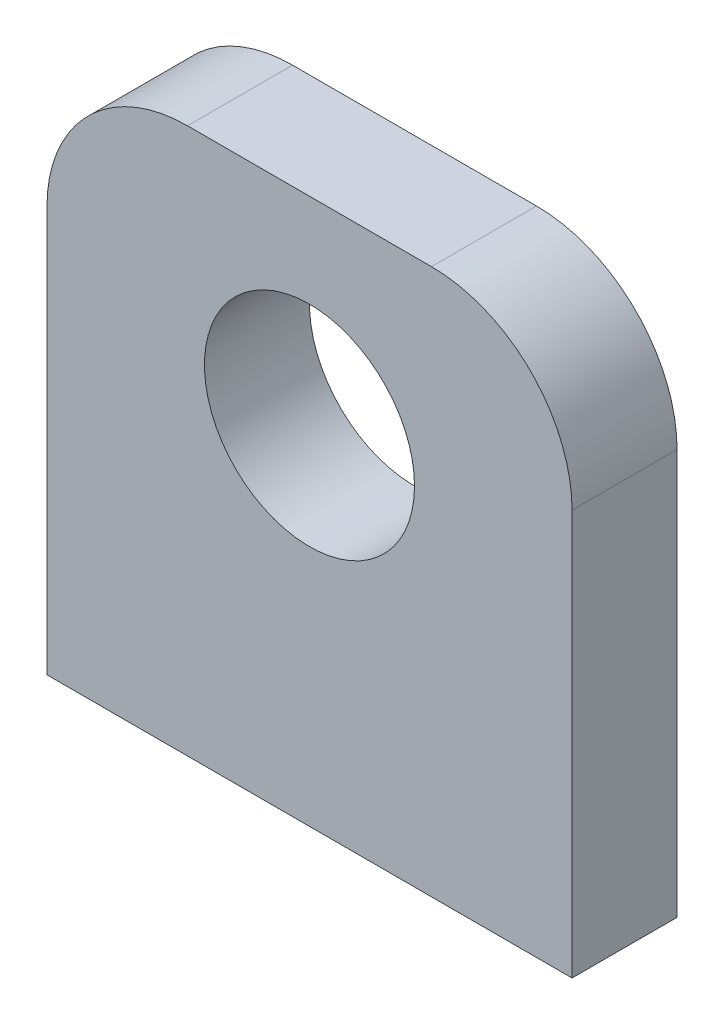
from build123d import *

# Parameters (mm, degrees)
CROQUIS1_W              = 63.5
CROQUIS1_H              = 66
CROQUIS1_R              = 12.7
SALIENTE_EXTRUIR1_DEPTH = 12.7
REDONDEO1_R             = 17


with BuildPart() as part:
    # Croquis1 → Saliente-Extruir1 (new body)
    with BuildSketch(Plane.XY):
        with Locations((31.75, 33)):
            Rectangle(CROQUIS1_W, CROQUIS1_H)
        with Locations((31.75, 42)):
            Circle(CROQUIS1_R, mode=Mode.SUBTRACT)
    extrude(amount=SALIENTE_EXTRUIR1_DEPTH)

    # Redondeo1
    redondeo1_edges = [part.edges().sort_by_distance(p)[0] for p in [
        (0, 66, 6.35),
        (63.5, 66, 6.35),
    ]]
    fillet(redondeo1_edges, radius=REDONDEO1_R)


solid = part.part
